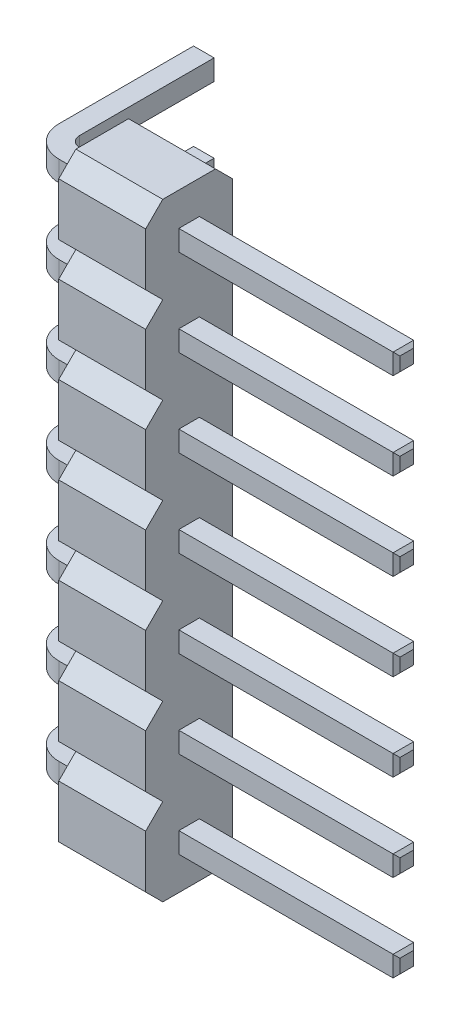
from build123d import *

# Parameters (mm, degrees)
PLASTIC_DEPTH   = 2.54
CONTACT_DEPTH   = 0.3
CHAMFER1_SIZE   = 0.1
LPATTERN1_COUNT = 7
LPATTERN1_PITCH = 2.54


with BuildPart() as part:
    # Sketch1 → Plastic (new body)
    with BuildSketch(Plane(origin=(0, 0, 0), x_dir=(0, 0, -1), z_dir=(1, 0, 0))):
        Polygon((-2.04, 1.27), (-0.5, 1.27), (0, 0.77), (0, -0.77), (-0.5, -1.27), (-2.04, -1.27), (-2.54, -0.77), (-2.54, 0.77), align=None)
    extrude(amount=PLASTIC_DEPTH)

    # Sketch2 → Contact (add, symmetric)
    with BuildSketch(Plane(origin=(0, 0, 0), x_dir=(1, 0, 0), z_dir=(0, 1, 0))):
        with BuildLine():
            Line((-1.86, 3.36), (-1.86, -0.67))
            ThreePointArc((-1.86, -0.67), (-1.596396103, -1.306396103), (-0.96, -1.57))
            Line((-0.96, -1.57), (8.9, -1.57))
            Line((8.9, -1.57), (8.9, -0.97))
            Line((8.9, -0.97), (-0.96, -0.97))
            ThreePointArc((-0.96, -0.97), (-1.172132034, -0.882132034), (-1.26, -0.67))
            Line((-1.26, -0.67), (-1.26, 3.36))
            Line((-1.26, 3.36), (-1.86, 3.36))
        make_face()
    extrude(amount=CONTACT_DEPTH, both=True)

    # Chamfer1
    chamfer1_edges = [part.edges().sort_by_distance(p)[0] for p in [
        (8.9, 0.3, 1.27),
        (8.9, 0, 1.57),
        (8.9, -0.3, 1.27),
        (8.9, 0, 0.97),
        (-1.56, 0.3, -3.36),
        (-1.26, 0, -3.36),
        (-1.86, 0, -3.36),
        (-1.56, -0.3, -3.36),
    ]]
    chamfer(chamfer1_edges, length=CHAMFER1_SIZE)

    # LPattern1: part ×7


with BuildPart() as part_1:
    add(part.part)
    with Locations(*[(0, i * LPATTERN1_PITCH, 0) for i in range(1, LPATTERN1_COUNT)]):
        add(part.part)


solid = part_1.part
